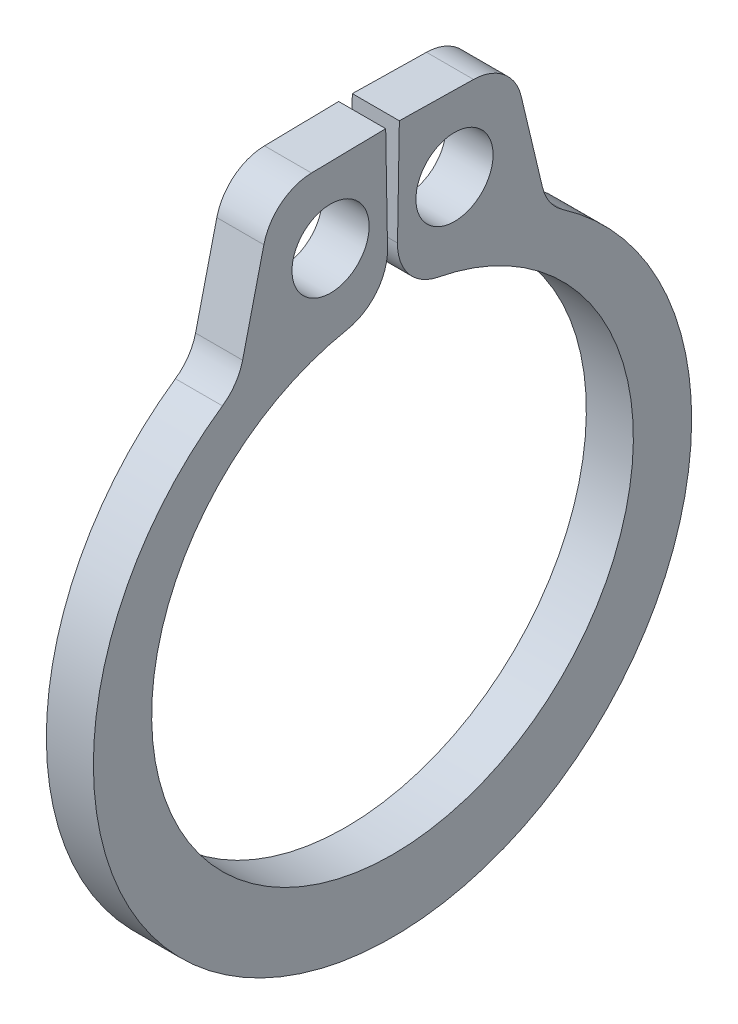
from build123d import *

# Parameters (mm, degrees)
BOSS_EXTRUDE1_DEPTH      = 0.3175
BOSS_EXTRUDE1_DEPTH_BACK = 0.3175
SKETCH3_R                = 0.5207
FILLET1_R                = 0.6731


with BuildPart() as part:
    # Sketch3 → Boss-Extrude1 (new, two sides: drawn at the far end of the back side and taken through both)
    with BuildSketch(Plane(origin=(0, 0, 0), x_dir=(0, 0, -1), z_dir=(1, 0, 0)).offset(-BOSS_EXTRUDE1_DEPTH_BACK)):
        with BuildLine():
            Line((-1.615972441, 5.255797876), (-2.085986783, 3.278903716))
            ThreePointArc((-2.085986783, 3.278903716), (0, -4.2164), (2.085986783, 3.278903716))
            Line((2.085986783, 3.278903716), (1.615972441, 5.255797876))
            Line((1.615972441, 5.255797876), (0.092204554, 5.282395343))
            Line((0.092204554, 5.282395343), (0.056741264, 3.250704826))
            ThreePointArc((0.056741264, 3.250704826), (0, -3.2512), (-0.056741264, 3.250704826))
            Line((-0.056741264, 3.250704826), (-0.092204554, 5.282395343))
            Line((-0.092204554, 5.282395343), (-1.615972441, 5.255797876))
        make_face()
        with Locations((-0.836356852, 4.253251351)):
            Circle(SKETCH3_R, mode=Mode.SUBTRACT)
        with Locations((0.836356852, 4.253251351)):
            Circle(SKETCH3_R, mode=Mode.SUBTRACT)
    extrude(amount=BOSS_EXTRUDE1_DEPTH + BOSS_EXTRUDE1_DEPTH_BACK)

    # Fillet1
    fillet1_edges = [part.edges().sort_by_distance(p)[0] for p in [
        (0, 3.278903716, 2.085986783),
        (0, 5.255797876, 1.615972441),
        (0, 3.250704826, 0.056741264),
        (0, 3.250704826, -0.056741264),
        (0, 5.255797876, -1.615972441),
        (0, 3.278903716, -2.085986783),
    ]]
    fillet(fillet1_edges, radius=FILLET1_R)


solid = part.part
